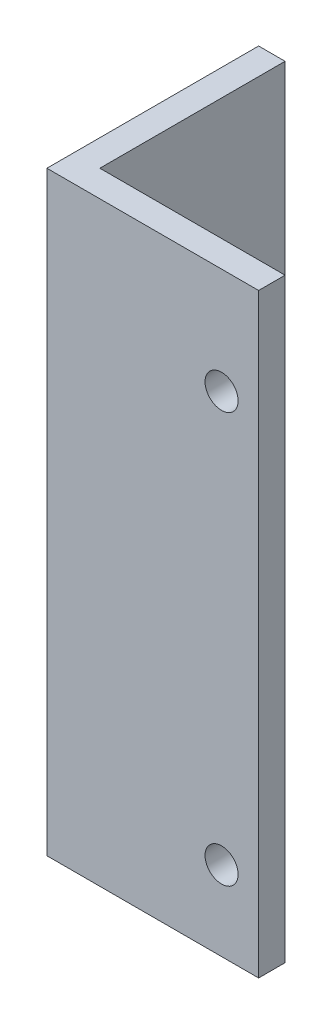
from build123d import *

# Parameters (mm, degrees)
BOSS_EXTRUDE1_DEPTH = 45
SKETCH2_R           = 1.25
CUT_EXTRUDE1_DEPTH  = 50.769468553
SKETCH3_R           = 1.25
CUT_EXTRUDE2_DEPTH  = 50.769468553


with BuildPart() as part:
    # Sketch1 → Boss-Extrude1 (new body)
    with BuildSketch(Plane(origin=(0, 0, 0), x_dir=(1, 0, 0), z_dir=(0, 1, 0))):
        Polygon((0, 0), (16, 0), (16, 2), (2, 2), (2, 16), (0, 16), align=None)
    extrude(amount=BOSS_EXTRUDE1_DEPTH)

    # Sketch2 → Cut-Extrude1 (cut, through all)
    with BuildSketch(Plane(origin=(0, 0, -2), x_dir=(-1, 0, 0), z_dir=(0, 0, -1))):
        with Locations((-13.2, 37)):
            Circle(SKETCH2_R)
        with Locations((-13.2, 6)):
            Circle(SKETCH2_R)
    extrude(amount=-CUT_EXTRUDE1_DEPTH, mode=Mode.SUBTRACT)

    # Sketch3 → Cut-Extrude2 (cut, through all)
    with BuildSketch(Plane(origin=(2, 0, 0), x_dir=(0, 0, -1), z_dir=(1, 0, 0))):
        with Locations((13, 9.5)):
            Circle(SKETCH3_R)
        with Locations((5, 13.5)):
            Circle(SKETCH3_R)
    extrude(amount=-CUT_EXTRUDE2_DEPTH, mode=Mode.SUBTRACT)


solid = part.part
